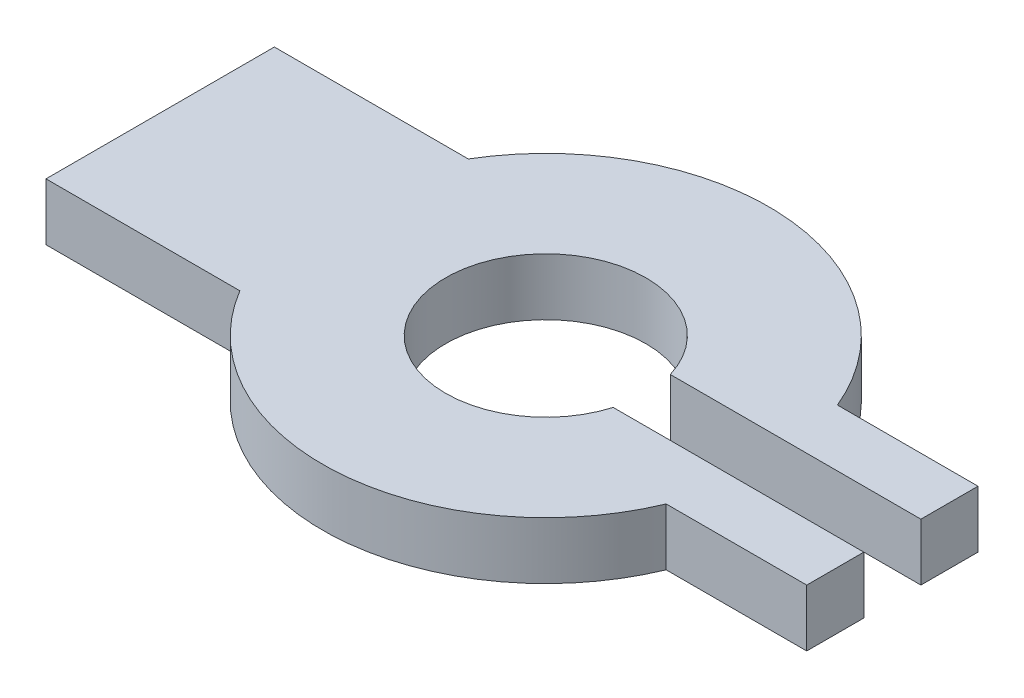
from build123d import *

# Parameters (mm, degrees)
BOSS_EXTRUDE1_DEPTH = 6.35


with BuildPart() as part:
    # Sketch1 → Boss-Extrude1 (new body)
    with BuildSketch(Plane(origin=(0, 0, 0), x_dir=(1, 0, 0), z_dir=(0, 1, 0))):
        with BuildLine():
            Line((-33.137943546, 12.576818285), (-39.487943546, 12.576818285))
            Line((-39.487943546, 12.576818285), (-39.487943546, -12.823181715))
            Line((-39.487943546, -12.823181715), (-33.137943546, -12.823181715))
            Line((-33.137943546, -12.823181715), (-17.921975594, -12.823181715))
            ThreePointArc((-17.921975594, -12.823181715), (5.176532213, -24.877142303), (26.316962394, -9.648181715))
            Line((26.316962394, -9.648181715), (41.951577839, -9.648181715))
            Line((41.951577839, -9.648181715), (41.951577839, -3.298181715))
            Line((41.951577839, -3.298181715), (14.07573237, -3.298181715))
            ThreePointArc((14.07573237, -3.298181715), (-7.737943546, -0.123181715), (14.07573237, 3.051818285))
            Line((14.07573237, 3.051818285), (41.951577839, 3.051818285))
            Line((41.951577839, 3.051818285), (41.951577839, 9.401818285))
            Line((41.951577839, 9.401818285), (26.316962394, 9.401818285))
            ThreePointArc((26.316962394, 9.401818285), (5.176532213, 24.630778874), (-17.921975594, 12.576818285))
            Line((-17.921975594, 12.576818285), (-33.137943546, 12.576818285))
        make_face()
    extrude(amount=BOSS_EXTRUDE1_DEPTH)


solid = part.part
